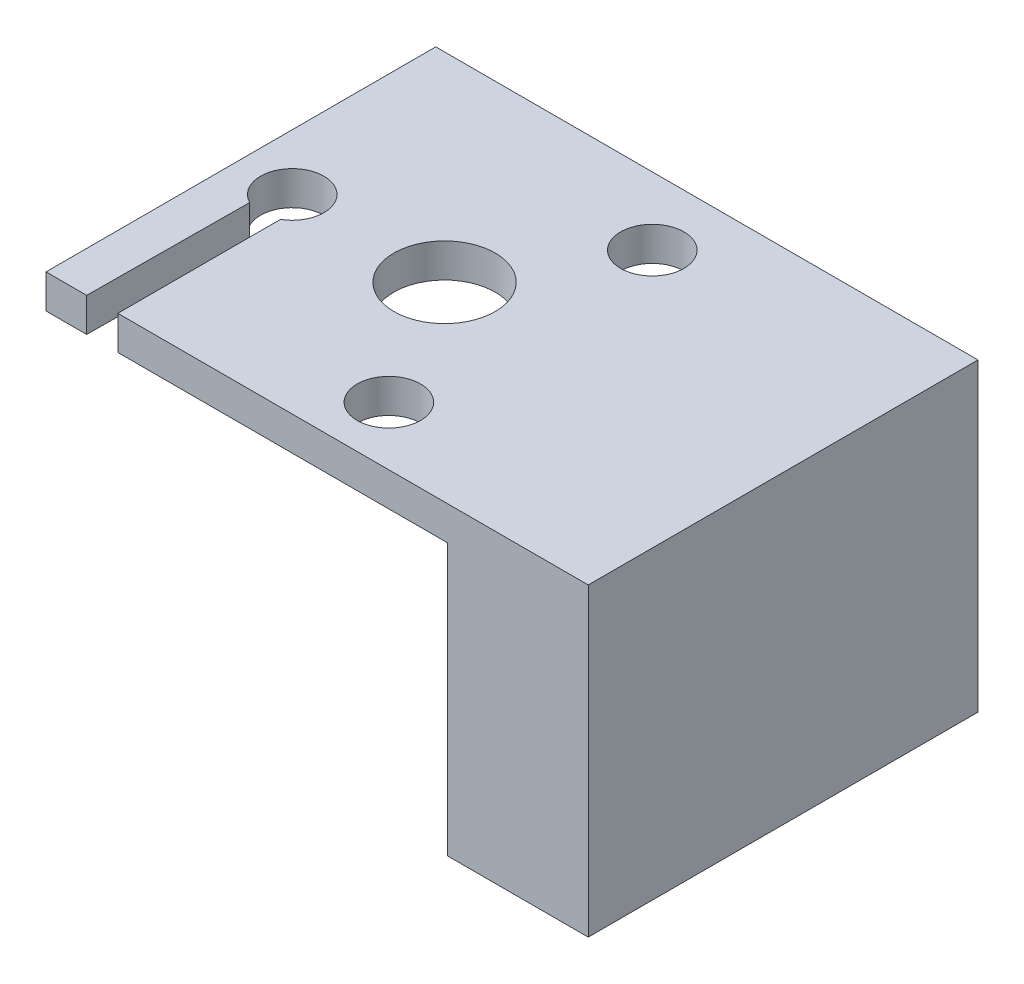
from build123d import *

# Parameters (mm, degrees)
SKETCH1_R           = 4.748524974
SKETCH1_R_2         = 2.967828109
BOSS_EXTRUDE1_DEPTH = 3.175
BOSS_EXTRUDE2_DEPTH = 25.4


with BuildPart() as part:
    # Sketch1 → Boss-Extrude1 (new body)
    with BuildSketch(Plane(origin=(0, 0, 0), x_dir=(1, 0, 0), z_dir=(0, 1, 0))):
        with BuildLine():
            Line((-12.535412203, -0.532735955), (-12.641288389, -15.698136108))
            Line((-12.641288389, -15.698136108), (-16.451288389, -15.698136108))
            Line((-16.451288389, -15.698136108), (-16.451288389, 20.814363892))
            Line((-16.451288389, 20.814363892), (34.348711611, 20.814363892))
            Line((34.348711611, 20.814363892), (34.348711611, -15.698136108))
            Line((34.348711611, -15.698136108), (-9.725725357, -15.698136108))
            Line((-9.725725357, -15.698136108), (-9.725725357, -0.458136108))
            ThreePointArc((-9.725725357, -0.458136108), (-11.278719551, 5.08443165), (-12.535412203, -0.532735955))
        make_face()
        with Locations(Location((3.061154267, 2.126474445, 0), (0, 0, 270))):
            Circle(SKETCH1_R, mode=Mode.SUBTRACT)
        with Locations(Location((10.183941728, 14.463504219, 0), (0, 0, 270))):
            Circle(SKETCH1_R_2, mode=Mode.SUBTRACT)
        with Locations(Location((10.183941728, -10.210555329, 0), (0, 0, 270))):
            Circle(SKETCH1_R_2, mode=Mode.SUBTRACT)
    extrude(amount=BOSS_EXTRUDE1_DEPTH)

    # Sketch2 → Boss-Extrude2 (add)
    with BuildSketch(Plane.XZ):
        with BuildLine():
            Line((20.263560728, -20.814363892), (34.348711611, -20.814363892))
            Line((34.348711611, -20.814363892), (34.348711611, 15.698136108))
            Line((34.348711611, 15.698136108), (21.156547566, 15.698136108))
            ThreePointArc((21.156547566, 15.698136108), (28.453561223, -2.747496977), (20.263560728, -20.814363892))
        make_face()
    extrude(amount=BOSS_EXTRUDE2_DEPTH)


solid = part.part
